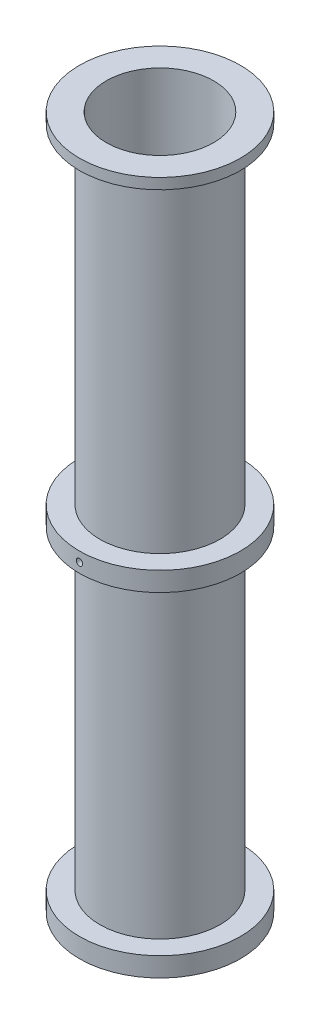
from build123d import *

# Parameters (mm, degrees)
CUT_EXTRUDE1_REACH      = 335.707
CUT_EXTRUDE1_END_RADIUS = 25
SKETCH2_R               = 1.5
CIRPATTERN1_COUNT       = 2


with BuildPart() as part:
    # Sketch1 → Revolve1 (revolve)
    with BuildSketch(Plane(origin=(0, 0, 0), x_dir=(0, 0, -1), z_dir=(1, 0, 0))):
        Polygon((0, 0), (-37.5, 0), (-37.5, 9), (-28, 9), (-28, 155.5), (-37.5, 155.5), (-37.5, 164.5), (-28, 164.5), (-28, 318), (-37.5, 318), (-37.5, 323), (-25, 323), (-25, 3), (0, 3), align=None)
    revolve(axis=Axis((0, 3, 0), (0, -1, 0)))

    # Cut-Extrude1: up to this cylinder (the profile starts outside it)
    cut_extrude1_end = Plane(origin=(0, 160, 0), z_dir=(0, 1, 0)) * Cylinder(CUT_EXTRUDE1_END_RADIUS, 722.414, mode=Mode.PRIVATE)
    # Sketch2 → Cut-Extrude1 (cut, up to the surface)
    with BuildSketch(Plane(origin=(0, 0, -37.5), x_dir=(-1, 0, 0), z_dir=(0, 0, -1)), mode=Mode.PRIVATE) as cut_extrude1_sk1:
        with Locations(Location((0, 160, 0), (0, 0, 90))):
            Circle(SKETCH2_R)
    cut_extrude1_tool1 = extrude(cut_extrude1_sk1.sketch, amount=-CUT_EXTRUDE1_REACH, mode=Mode.PRIVATE) - cut_extrude1_end
    cut_extrude1 = cut_extrude1_tool1.solids().sort_by_distance((0, 160, -37.5))[0]
    add(cut_extrude1, mode=Mode.SUBTRACT)

    # CirPattern1: Cut-Extrude1 ×2 about axis
    cirpattern1_axis = Axis((0, 3, 0), (0, 1, 0))
    for i in range(1, CIRPATTERN1_COUNT):
        add(cut_extrude1.rotate(cirpattern1_axis, i * 360 / CIRPATTERN1_COUNT), mode=Mode.SUBTRACT)


solid = part.part
